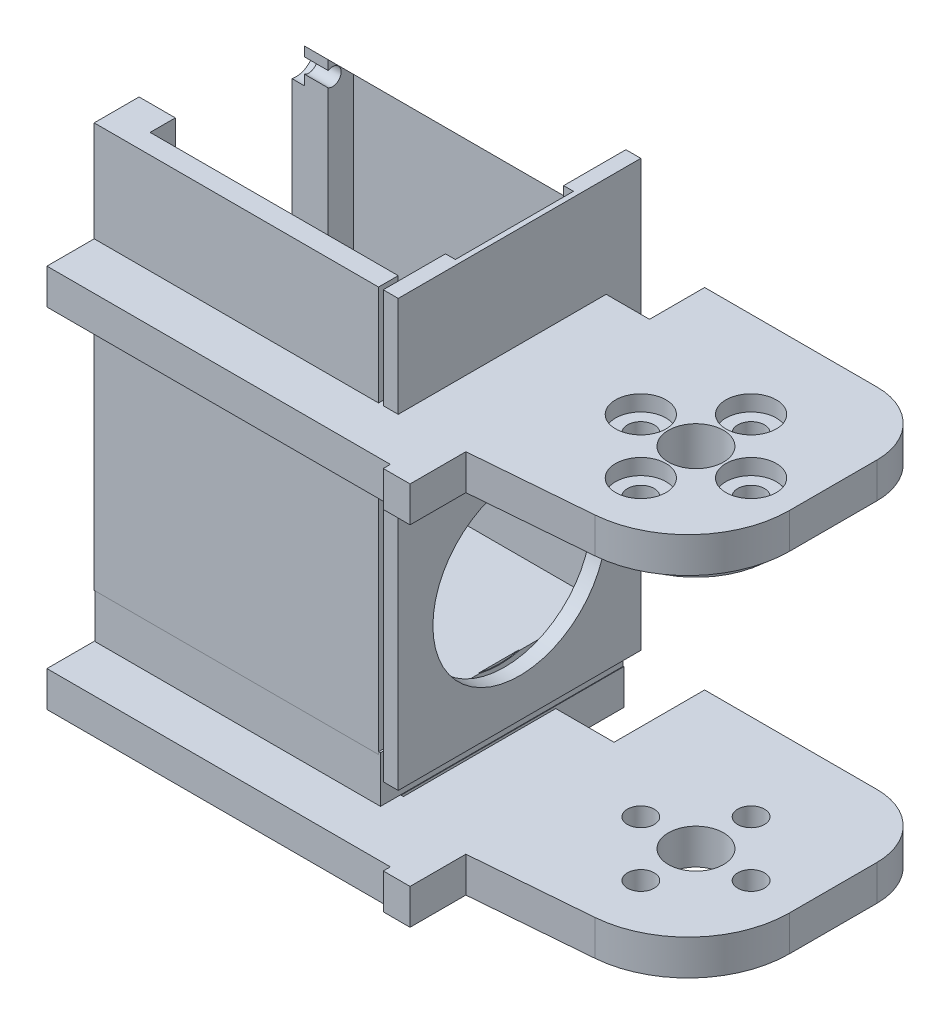
from build123d import *

# Parameters (mm, degrees)
BOSS_1_DEPTH    = 4.5
S_CYL2_R        = 9.5
BOSS_2_DEPTH    = 3.2
BOSS_3_DEPTH    = 4.5
S_PRISM4_W      = 7.5
S_PRISM4_H      = 21.95
BOSS_4_DEPTH    = 4.5
S_PRISM5_W      = 44.2
S_PRISM5_H      = 8.55
BOSS_5_DEPTH    = 4.5
S_PRISM6_W      = 36.4
S_PRISM6_H      = 30.9
BOSS_6_DEPTH    = 4.5
S_PRISM7_W      = 3.4
S_PRISM7_H      = 7.9
BOSS_7_DEPTH    = 4.5
S_PRISM8_W      = 7.5
S_PRISM8_H      = 26.45
BOSS_8_DEPTH    = 4.5
S_PRISM9_W      = 44.2
S_PRISM9_H      = 8.55
BOSS_9_DEPTH    = 4.5
S_PRISM10_W     = 3.4
S_PRISM10_H     = 7.9
BOSS_10_DEPTH   = 4.5
S_BOX11_W       = 36.1
S_BOX11_H       = 2.5
BOSS_11_DEPTH   = 30.8
S_BOX12_W       = 36.1
S_BOX12_H       = 51.4
BOSS_12_DEPTH   = 2.5
S_BOX13_W       = 36.1
S_BOX13_H       = 51.4
BOSS_13_DEPTH   = 2.5
S_BOX14_W       = 4.6
S_BOX14_H       = 51.4
BOSS_14_DEPTH   = 30.8
S_BOX15_W       = 1.9
S_BOX15_H       = 54.1
BOSS_15_DEPTH   = 30.8
S_BOX16_W       = 36.26
S_BOX16_H       = 6
BOSS_16_DEPTH   = 30.76
S_HOLE17_R      = 3.5
HOLE_17_DEPTH   = 4.7
S_HOLE18_R      = 1.7
HOLE_18_DEPTH   = 4.7
S_HOLE19_R      = 1.7
HOLE_19_DEPTH   = 4.7
S_HOLE20_R      = 1.7
HOLE_20_DEPTH   = 4.7
S_HOLE21_R      = 1.7
HOLE_21_DEPTH   = 4.7
S_HOLE22_R      = 3.2
HOLE_22_DEPTH   = 1.6
S_HOLE23_R      = 3.2
HOLE_23_DEPTH   = 1.6
S_HOLE24_R      = 3.2
HOLE_24_DEPTH   = 1.6
S_HOLE25_R      = 3.2
HOLE_25_DEPTH   = 1.6
S_HOLE26_R      = 3.5
HOLE_26_DEPTH   = 7.9
S_HOLE27_R      = 1.7
HOLE_27_DEPTH   = 7.9
S_HOLE28_R      = 1.7
HOLE_28_DEPTH   = 7.9
S_HOLE29_R      = 1.7
HOLE_29_DEPTH   = 7.9
S_HOLE30_R      = 1.7
HOLE_30_DEPTH   = 7.9
S_HOLE31_R      = 3.2
HOLE_31_DEPTH   = 2.1
S_HOLE32_R      = 3.2
HOLE_32_DEPTH   = 2.1
S_HOLE33_R      = 3.2
HOLE_33_DEPTH   = 2.1
S_HOLE34_R      = 3.2
HOLE_34_DEPTH   = 2.1
S_CUT35_W       = 6.8
S_CUT35_H       = 1
POCKET_35_DEPTH = 10
S_HOLE36_R      = 10.5
HOLE_36_DEPTH   = 4.8
S_CUT37_W       = 4.75
S_CUT37_H       = 19.5
POCKET_37_DEPTH = 19.4
S_CUT38_W       = 4.75
S_CUT38_H       = 8.3
POCKET_38_DEPTH = 19.4
S_CUT39_W       = 4.75
S_CUT39_H       = 11
POCKET_39_DEPTH = 7
S_CUT40_W       = 2.9
S_CUT40_H       = 20
POCKET_40_DEPTH = 15.9
S_HOLE41_R      = 1.1
HOLE_41_DEPTH   = 4.8
S_HOLE42_R      = 2.3
HOLE_42_DEPTH   = 1.7
S_HOLE43_R      = 1.1
HOLE_43_DEPTH   = 4.8
S_HOLE44_R      = 2.3
HOLE_44_DEPTH   = 1.7
S_HOLE45_R      = 1.1
HOLE_45_DEPTH   = 4.8
S_HOLE46_R      = 2.3
HOLE_46_DEPTH   = 1.7
S_HOLE47_R      = 11
HOLE_47_DEPTH   = 2.7
S_CUT48_W       = 1.85
S_CUT48_H       = 30.6
POCKET_48_DEPTH = 15
CUT_49_DEPTH    = 36.3


with BuildPart() as part:
    # S_prism1 → Boss_1 (new body)
    with BuildSketch(Plane(origin=(0, -23.3, 0), x_dir=(1, 0, 0), z_dir=(0, 1, 0))):
        with BuildLine():
            Line((13, 10), (13, -1.1138))
            ThreePointArc((13, -1.1138), (9.586829994, -9.855067448), (1.1535, -13.9707))
            Line((1.1535, -13.9707), (-16.9, -15.45))
            Line((-16.9, -15.45), (-16.9, 18))
            Line((-16.9, 18), (5, 18))
            ThreePointArc((5, 18), (10.6569, 15.6569), (13, 10))
        make_face()
    extrude(amount=BOSS_1_DEPTH)

    # S_prism4 → Boss_4 (add)
    with BuildSketch(Plane(origin=(0, -23.3, 0), x_dir=(1, 0, 0), z_dir=(0, 1, 0))):
        with Locations((-20.55, -4.475)):
            Rectangle(S_PRISM4_W, S_PRISM4_H)
    extrude(amount=BOSS_4_DEPTH)

    # S_prism5 → Boss_5 (add)
    with BuildSketch(Plane(origin=(0, -23.3, 0), x_dir=(1, 0, 0), z_dir=(0, 1, 0))):
        with Locations((-38.9, -17.125)):
            Rectangle(S_PRISM5_W, S_PRISM5_H)
    extrude(amount=BOSS_5_DEPTH)

    # S_prism6 → Boss_6 (add)
    with BuildSketch(Plane(origin=(0, -23.3, 0), x_dir=(1, 0, 0), z_dir=(0, 1, 0))):
        with Locations((-42.8, 0)):
            Rectangle(S_PRISM6_W, S_PRISM6_H)
    extrude(amount=BOSS_6_DEPTH)

    # S_prism7 → Boss_7 (add)
    with BuildSketch(Plane(origin=(0, -23.3, 0), x_dir=(1, 0, 0), z_dir=(0, 1, 0))):
        with Locations((-15.7, -18.35)):
            Rectangle(S_PRISM7_W, S_PRISM7_H)
    extrude(amount=BOSS_7_DEPTH)



with BuildPart() as body_2:
    # S_cyl2 → Boss_2 (new body)
    with BuildSketch(Plane(origin=(0, 17.75, 0), x_dir=(1, 0, 0), z_dir=(0, 1, 0))):
        with Locations(Location((0, 0, 0), (0, 0, 270))):
            Circle(S_CYL2_R)
    extrude(amount=BOSS_2_DEPTH)

    # S_prism3 → Boss_3 (add)
    with BuildSketch(Plane(origin=(0, 20.95, 0), x_dir=(1, 0, 0), z_dir=(0, 1, 0))):
        with BuildLine():
            Line((13, 10), (13, -1.1138))
            ThreePointArc((13, -1.1138), (9.586829994, -9.855067448), (1.1535, -13.9707))
            Line((1.1535, -13.9707), (-16.9, -15.45))
            Line((-16.9, -15.45), (-16.9, 18))
            Line((-16.9, 18), (5, 18))
            ThreePointArc((5, 18), (10.6569, 15.6569), (13, 10))
        make_face()
    extrude(amount=BOSS_3_DEPTH)

    # S_prism8 → Boss_8 (add)
    with BuildSketch(Plane(origin=(0, 20.95, 0), x_dir=(1, 0, 0), z_dir=(0, 1, 0))):
        with Locations((-20.55, -2.225)):
            Rectangle(S_PRISM8_W, S_PRISM8_H)
    extrude(amount=BOSS_8_DEPTH)

    # S_prism9 → Boss_9 (add)
    with BuildSketch(Plane(origin=(0, 20.95, 0), x_dir=(1, 0, 0), z_dir=(0, 1, 0))):
        with Locations((-38.9, -17.125)):
            Rectangle(S_PRISM9_W, S_PRISM9_H)
    extrude(amount=BOSS_9_DEPTH)

    # S_prism10 → Boss_10 (add)
    with BuildSketch(Plane(origin=(0, 20.95, 0), x_dir=(1, 0, 0), z_dir=(0, 1, 0))):
        with Locations((-15.7, -18.35)):
            Rectangle(S_PRISM10_W, S_PRISM10_H)
    extrude(amount=BOSS_10_DEPTH)



with BuildPart() as body_3:
    # S_box11 → Boss_11 (new body)
    with BuildSketch(Plane.XY.offset(-15.4)):
        with Locations((-42.95, -11.95)):
            Rectangle(S_BOX11_W, S_BOX11_H)
    extrude(amount=BOSS_11_DEPTH)

    # S_box12 → Boss_12 (add)
    with BuildSketch(Plane.XY.offset(-15.4)):
        with Locations((-42.95, 12.5)):
            Rectangle(S_BOX12_W, S_BOX12_H)
    extrude(amount=BOSS_12_DEPTH)


with BuildPart() as body_2_1:
    add(body_2.part)

    add(body_3.part)  # Boss_13 merges body 3
    # S_box13 → Boss_13 (add)
    with BuildSketch(Plane.XY.offset(12.9)):
        with Locations((-42.95, 12.5)):
            Rectangle(S_BOX13_W, S_BOX13_H)
    extrude(amount=BOSS_13_DEPTH)

    # S_box14 → Boss_14 (add)
    with BuildSketch(Plane.XY.offset(-15.4)):
        with Locations((-58.7, 12.5)):
            Rectangle(S_BOX14_W, S_BOX14_H)
    extrude(amount=BOSS_14_DEPTH)

    # S_box15 → Boss_15 (add)
    with BuildSketch(Plane.XY.offset(-15.4)):
        with Locations((-23.35, 11.15)):
            Rectangle(S_BOX15_W, S_BOX15_H)
    extrude(amount=BOSS_15_DEPTH)


with BuildPart() as part_1:
    add(part.part)

    add(body_2_1.part)  # Boss_16 merges body 2
    # S_box16 → Boss_16 (add)
    with BuildSketch(Plane.XY.offset(-15.38)):
        with Locations((-42.8, -15.9)):
            Rectangle(S_BOX16_W, S_BOX16_H)
    extrude(amount=BOSS_16_DEPTH)

    # S_hole17 → Hole_17 (cut)
    with BuildSketch(Plane(origin=(0, -23.4, 0), x_dir=(1, 0, 0), z_dir=(0, 1, 0))):
        with Locations(Location((0, 0, 0), (0, 0, 90))):
            Circle(S_HOLE17_R)
    extrude(amount=HOLE_17_DEPTH, mode=Mode.SUBTRACT)

    # S_hole18 → Hole_18 (cut)
    with BuildSketch(Plane(origin=(0, -23.4, 0), x_dir=(1, 0, 0), z_dir=(0, 1, 0))):
        with Locations(Location((7, 0, 0), (0, 0, 90))):
            Circle(S_HOLE18_R)
    extrude(amount=HOLE_18_DEPTH, mode=Mode.SUBTRACT)

    # S_hole19 → Hole_19 (cut)
    with BuildSketch(Plane(origin=(0, -23.4, 0), x_dir=(1, 0, 0), z_dir=(0, 1, 0))):
        with Locations(Location((0, -7, 0), (0, 0, 90))):
            Circle(S_HOLE19_R)
    extrude(amount=HOLE_19_DEPTH, mode=Mode.SUBTRACT)

    # S_hole20 → Hole_20 (cut)
    with BuildSketch(Plane(origin=(0, -23.4, 0), x_dir=(1, 0, 0), z_dir=(0, 1, 0))):
        with Locations(Location((-7, 0, 0), (0, 0, 90))):
            Circle(S_HOLE20_R)
    extrude(amount=HOLE_20_DEPTH, mode=Mode.SUBTRACT)

    # S_hole21 → Hole_21 (cut)
    with BuildSketch(Plane(origin=(0, -23.4, 0), x_dir=(1, 0, 0), z_dir=(0, 1, 0))):
        with Locations(Location((0, 7, 0), (0, 0, 90))):
            Circle(S_HOLE21_R)
    extrude(amount=HOLE_21_DEPTH, mode=Mode.SUBTRACT)

    # S_hole22 → Hole_22 (cut)
    with BuildSketch(Plane(origin=(0, -23.4, 0), x_dir=(1, 0, 0), z_dir=(0, 1, 0))):
        with Locations(Location((7, 0, 0), (0, 0, 90))):
            Circle(S_HOLE22_R)
    extrude(amount=HOLE_22_DEPTH, mode=Mode.SUBTRACT)

    # S_hole23 → Hole_23 (cut)
    with BuildSketch(Plane(origin=(0, -23.4, 0), x_dir=(1, 0, 0), z_dir=(0, 1, 0))):
        with Locations(Location((0, -7, 0), (0, 0, 90))):
            Circle(S_HOLE23_R)
    extrude(amount=HOLE_23_DEPTH, mode=Mode.SUBTRACT)

    # S_hole24 → Hole_24 (cut)
    with BuildSketch(Plane(origin=(0, -23.4, 0), x_dir=(1, 0, 0), z_dir=(0, 1, 0))):
        with Locations(Location((-7, 0, 0), (0, 0, 90))):
            Circle(S_HOLE24_R)
    extrude(amount=HOLE_24_DEPTH, mode=Mode.SUBTRACT)

    # S_hole25 → Hole_25 (cut)
    with BuildSketch(Plane(origin=(0, -23.4, 0), x_dir=(1, 0, 0), z_dir=(0, 1, 0))):
        with Locations(Location((0, 7, 0), (0, 0, 90))):
            Circle(S_HOLE25_R)
    extrude(amount=HOLE_25_DEPTH, mode=Mode.SUBTRACT)

    # S_hole26 → Hole_26 (cut)
    with BuildSketch(Plane(origin=(0, 17.65, 0), x_dir=(1, 0, 0), z_dir=(0, 1, 0))):
        with Locations(Location((0, 0, 0), (0, 0, 90))):
            Circle(S_HOLE26_R)
    extrude(amount=HOLE_26_DEPTH, mode=Mode.SUBTRACT)

    # S_hole27 → Hole_27 (cut)
    with BuildSketch(Plane(origin=(0, 17.65, 0), x_dir=(1, 0, 0), z_dir=(0, 1, 0))):
        with Locations(Location((7, 0, 0), (0, 0, 90))):
            Circle(S_HOLE27_R)
    extrude(amount=HOLE_27_DEPTH, mode=Mode.SUBTRACT)

    # S_hole28 → Hole_28 (cut)
    with BuildSketch(Plane(origin=(0, 17.65, 0), x_dir=(1, 0, 0), z_dir=(0, 1, 0))):
        with Locations(Location((0, -7, 0), (0, 0, 90))):
            Circle(S_HOLE28_R)
    extrude(amount=HOLE_28_DEPTH, mode=Mode.SUBTRACT)

    # S_hole29 → Hole_29 (cut)
    with BuildSketch(Plane(origin=(0, 17.65, 0), x_dir=(1, 0, 0), z_dir=(0, 1, 0))):
        with Locations(Location((-7, 0, 0), (0, 0, 90))):
            Circle(S_HOLE29_R)
    extrude(amount=HOLE_29_DEPTH, mode=Mode.SUBTRACT)

    # S_hole30 → Hole_30 (cut)
    with BuildSketch(Plane(origin=(0, 17.65, 0), x_dir=(1, 0, 0), z_dir=(0, 1, 0))):
        with Locations(Location((0, 7, 0), (0, 0, 90))):
            Circle(S_HOLE30_R)
    extrude(amount=HOLE_30_DEPTH, mode=Mode.SUBTRACT)

    # S_hole31 → Hole_31 (cut)
    with BuildSketch(Plane(origin=(0, 23.45, 0), x_dir=(1, 0, 0), z_dir=(0, 1, 0))):
        with Locations(Location((7, 0, 0), (0, 0, 90))):
            Circle(S_HOLE31_R)
    extrude(amount=HOLE_31_DEPTH, mode=Mode.SUBTRACT)

    # S_hole32 → Hole_32 (cut)
    with BuildSketch(Plane(origin=(0, 23.45, 0), x_dir=(1, 0, 0), z_dir=(0, 1, 0))):
        with Locations(Location((0, -7, 0), (0, 0, 90))):
            Circle(S_HOLE32_R)
    extrude(amount=HOLE_32_DEPTH, mode=Mode.SUBTRACT)

    # S_hole33 → Hole_33 (cut)
    with BuildSketch(Plane(origin=(0, 23.45, 0), x_dir=(1, 0, 0), z_dir=(0, 1, 0))):
        with Locations(Location((-7, 0, 0), (0, 0, 90))):
            Circle(S_HOLE33_R)
    extrude(amount=HOLE_33_DEPTH, mode=Mode.SUBTRACT)

    # S_hole34 → Hole_34 (cut)
    with BuildSketch(Plane(origin=(0, 23.45, 0), x_dir=(1, 0, 0), z_dir=(0, 1, 0))):
        with Locations(Location((0, 7, 0), (0, 0, 90))):
            Circle(S_HOLE34_R)
    extrude(amount=HOLE_34_DEPTH, mode=Mode.SUBTRACT)

    # S_cut35 → Pocket_35 (cut)
    with BuildSketch(Plane.XY):
        with Locations((0, 18.15)):
            Rectangle(S_CUT35_W, S_CUT35_H)
    extrude(amount=POCKET_35_DEPTH, mode=Mode.SUBTRACT)

    # S_hole36 → Hole_36 (cut)
    with BuildSketch(Plane(origin=(-61.1, 0, 0), x_dir=(0, 0, -1), z_dir=(1, 0, 0))):
        with Locations(Location((0, 0, 0), (0, 0, 180))):
            Circle(S_HOLE36_R)
    extrude(amount=HOLE_36_DEPTH, mode=Mode.SUBTRACT)

    # S_cut37 → Pocket_37 (cut)
    with BuildSketch(Plane.XY.offset(-9.7)):
        with Locations((-58.725, 20.65)):
            Rectangle(S_CUT37_W, S_CUT37_H)
    extrude(amount=POCKET_37_DEPTH, mode=Mode.SUBTRACT)

    # S_cut38 → Pocket_38 (cut)
    with BuildSketch(Plane.XY.offset(-9.7)):
        with Locations((-58.725, 34.55)):
            Rectangle(S_CUT38_W, S_CUT38_H)
    extrude(amount=POCKET_38_DEPTH, mode=Mode.SUBTRACT)

    # S_cut39 → Pocket_39 (cut)
    with BuildSketch(Plane.XY.offset(-3.5)):
        with Locations((-58.725, 5.5)):
            Rectangle(S_CUT39_W, S_CUT39_H)
    extrude(amount=POCKET_39_DEPTH, mode=Mode.SUBTRACT)

    # S_cut40 → Pocket_40 (cut)
    with BuildSketch(Plane.XY.offset(-15.9)):
        with Locations((-59.75, 0)):
            Rectangle(S_CUT40_W, S_CUT40_H)
    extrude(amount=POCKET_40_DEPTH, mode=Mode.SUBTRACT)

    # S_hole41 → Hole_41 (cut)
    with BuildSketch(Plane(origin=(-61.1, 0, 0), x_dir=(0, 0, -1), z_dir=(1, 0, 0))):
        with Locations(Location((-10.25, 8.3, 0), (0, 0, 180))):
            Circle(S_HOLE41_R)
    extrude(amount=HOLE_41_DEPTH, mode=Mode.SUBTRACT)

    # S_hole42 → Hole_42 (cut)
    with BuildSketch(Plane(origin=(-61.1, 0, 0), x_dir=(0, 0, -1), z_dir=(1, 0, 0))):
        with Locations((-10.25, 8.3)):
            Circle(S_HOLE42_R)
    extrude(amount=HOLE_42_DEPTH, mode=Mode.SUBTRACT)

    # S_hole43 → Hole_43 (cut)
    with BuildSketch(Plane(origin=(-61.1, 0, 0), x_dir=(0, 0, -1), z_dir=(1, 0, 0))):
        with Locations((10.25, 32.75)):
            Circle(S_HOLE43_R)
    extrude(amount=HOLE_43_DEPTH, mode=Mode.SUBTRACT)

    # S_hole44 → Hole_44 (cut)
    with BuildSketch(Plane(origin=(-61.1, 0, 0), x_dir=(0, 0, -1), z_dir=(1, 0, 0))):
        with Locations((10.25, 32.75)):
            Circle(S_HOLE44_R)
    extrude(amount=HOLE_44_DEPTH, mode=Mode.SUBTRACT)

    # S_hole45 → Hole_45 (cut)
    with BuildSketch(Plane(origin=(-61.1, 0, 0), x_dir=(0, 0, -1), z_dir=(1, 0, 0))):
        with Locations((-10.25, 32.75)):
            Circle(S_HOLE45_R)
    extrude(amount=HOLE_45_DEPTH, mode=Mode.SUBTRACT)

    # S_hole46 → Hole_46 (cut)
    with BuildSketch(Plane(origin=(-61.1, 0, 0), x_dir=(0, 0, -1), z_dir=(1, 0, 0))):
        with Locations((-10.25, 32.75)):
            Circle(S_HOLE46_R)
    extrude(amount=HOLE_46_DEPTH, mode=Mode.SUBTRACT)

    # S_hole47 → Hole_47 (cut)
    with BuildSketch(Plane(origin=(-25, 0, 0), x_dir=(0, 0, -1), z_dir=(1, 0, 0))):
        with Locations(Location((0, 0, 0), (0, 0, 180))):
            Circle(S_HOLE47_R)
    extrude(amount=HOLE_47_DEPTH, mode=Mode.SUBTRACT)

    # S_cut48 → Pocket_48 (cut)
    with BuildSketch(Plane.XY.offset(-7.5)):
        with Locations((-23.975, 23.4)):
            Rectangle(S_CUT48_W, S_CUT48_H)
    extrude(amount=POCKET_48_DEPTH, mode=Mode.SUBTRACT)

    # S_pcut49 → Cut_49 (cut)
    with BuildSketch(Plane(origin=(-61.1, 0, 0), x_dir=(0, 0, -1), z_dir=(1, 0, 0))):
        Polygon((16, 38.8), (16, 28.6), (5.8, 38.8), align=None)
    extrude(amount=CUT_49_DEPTH, mode=Mode.SUBTRACT)


solid = part_1.part
